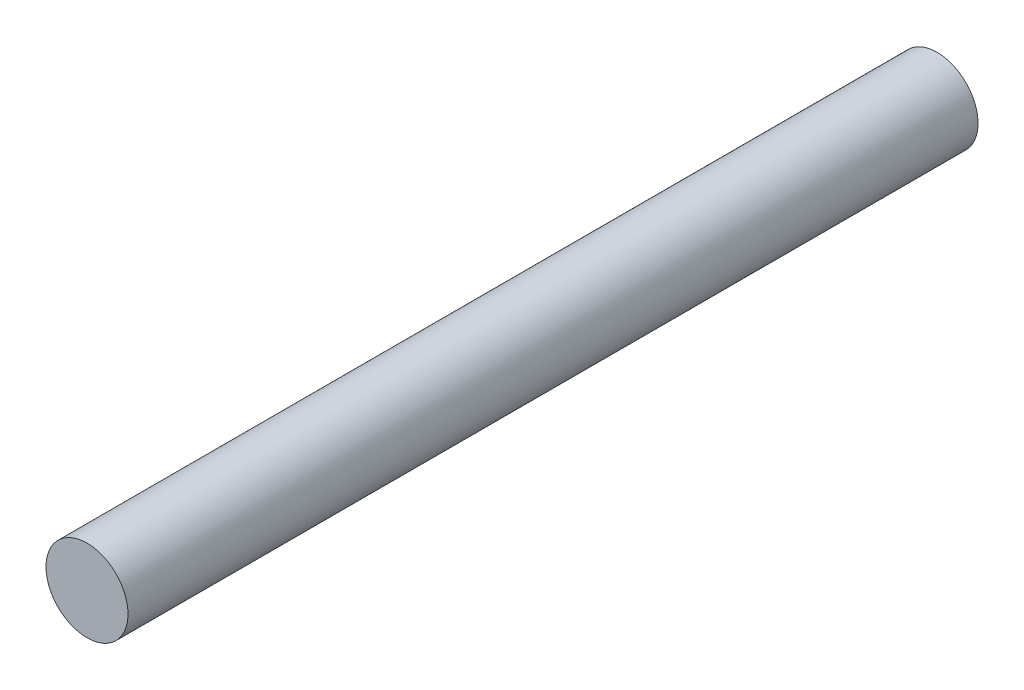
from build123d import *

# Parameters (mm, degrees)
SKETCH_1_R      = 2.75
EXTRUDE_1_DEPTH = 57


with BuildPart() as part:
    # 草图1 → 凸台-拉伸1 (new body)
    with BuildSketch(Plane.XY):
        with Locations(Location((0, 0, 0), (0, 0, 180))):
            Circle(SKETCH_1_R)
    extrude(amount=EXTRUDE_1_DEPTH)


solid = part.part
